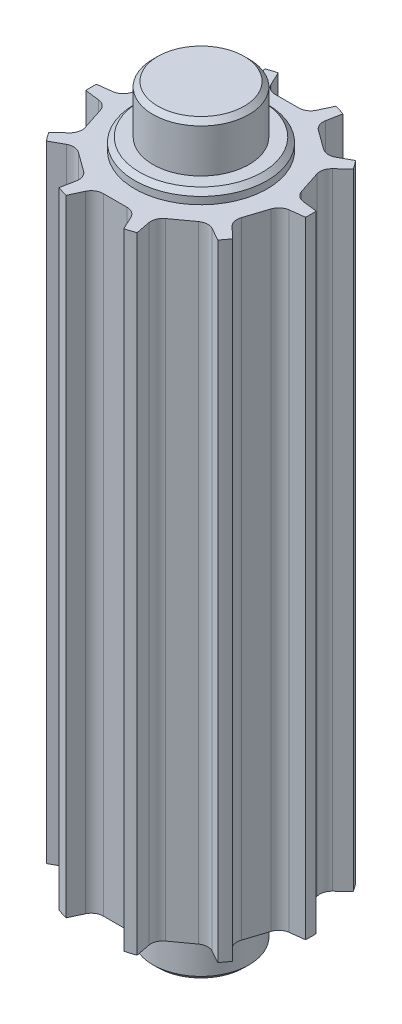
from build123d import *

# Parameters (mm, degrees)
SKIZZE1_R                       = 4.57
AUFSATZ_LINEAR_AUSTRAGEN1_DEPTH = 31
SCHNITT_LINEAR_AUSTRAGEN1_DEPTH = 32.666540702
VERRUNDUNG1_R                   = 0.5
KREISMUSTER1_COUNT              = 10
VERRUNDUNG1_OF_KREISMUSTER1_R   = 0.5
FASE1_SIZE                      = 0.2


with BuildPart() as part:
    # Skizze1 → Aufsatz-Linear austragen1 (new body)
    with BuildSketch(Plane(origin=(0, 0, 0), x_dir=(1, 0, 0), z_dir=(0, 1, 0))):
        Circle(SKIZZE1_R)
    extrude(amount=AUFSATZ_LINEAR_AUSTRAGEN1_DEPTH)

    # Skizze12 → Schnitt-Linear austragen1 (cut, through all)
    with BuildSketch(Plane(origin=(0, 31, 0), x_dir=(1, 0, 0), z_dir=(0, 1, 0))):
        with BuildLine():
            Line((-1.2, 4.409637173), (-0.808470756, 3.57))
            Line((-0.808470756, 3.57), (0.808470756, 3.57))
            Line((0.808470756, 3.57), (1.2, 4.409637173))
            ThreePointArc((1.2, 4.409637173), (0, 4.57), (-1.2, 4.409637173))
        make_face()
    schnitt_linear_austragen1 = extrude(amount=-SCHNITT_LINEAR_AUSTRAGEN1_DEPTH, mode=Mode.SUBTRACT)

    # Verrundung1
    verrundung1_edges = [part.edges().sort_by_distance(p)[0] for p in [
        (-0.808470756, 15.5, -3.57),
        (0.808470756, 15.5, -3.57),
    ]]
    fillet(verrundung1_edges, radius=VERRUNDUNG1_R)

    # Kreismuster1: Schnitt-Linear austragen1 ×10 about axis
    kreismuster1_axis = Axis((0, -1.826859831, 0), (0, 1, 0))
    for i in range(1, KREISMUSTER1_COUNT):
        add(schnitt_linear_austragen1.rotate(kreismuster1_axis, i * 360 / KREISMUSTER1_COUNT), mode=Mode.SUBTRACT)

    # Verrundung1 of Kreismuster1
    verrundung1_of_kreismuster1_edges = [part.edges().sort_by_distance(p)[0] for p in [
        (-2.752459932, 15.5, -2.412983483),
        (-1.44432677, 15.5, -3.363397857),
        (-3.645102966, 15.5, -0.334289289),
        (-3.14544056, 15.5, -1.872092051),
        (-3.14544056, 15.5, 1.872092051),
        (-3.645102966, 15.5, 0.334289289),
        (-1.44432677, 15.5, 3.363397857),
        (-2.752459932, 15.5, 2.412983483),
        (0.808470756, 15.5, 3.57),
        (-0.808470756, 15.5, 3.57),
        (2.752459932, 15.5, 2.412983483),
        (1.44432677, 15.5, 3.363397857),
        (3.645102966, 15.5, 0.334289289),
        (3.14544056, 15.5, 1.872092051),
        (3.14544056, 15.5, -1.872092051),
        (3.645102966, 15.5, -0.334289289),
        (1.44432677, 15.5, -3.363397857),
        (2.752459932, 15.5, -2.412983483),
    ]]
    fillet(verrundung1_of_kreismuster1_edges, radius=VERRUNDUNG1_OF_KREISMUSTER1_R)

    # Skizze13 → Schnitt-Rotation1 (revolve, cut)
    with BuildSketch(Plane(origin=(0, 0, 0), x_dir=(0, 0, -1), z_dir=(1, 0, 0))):
        Polygon((-1.995, 0), (-10.076763041, 0), (-10.076763041, 31), (-1.995, 31), (-1.995, 29), (-2.75, 29), (-2.75, 28.5), (-6.450923694, 28.5), (-6.450923694, 2.5), (-2.75, 2.5), (-2.75, 2), (-1.995, 2), align=None)
    revolve(axis=Axis((0, -5.607699778, 0), (0, 1, 0)), mode=Mode.SUBTRACT)

    # Fase1
    fase1_edges = [part.edges().sort_by_distance(p)[0] for p in [
        (0, 0, -1.995),
        (0, 2, -2.75),
        (0, 29, -2.75),
        (0, 31, -1.995),
    ]]
    chamfer(fase1_edges, length=FASE1_SIZE)

    # Skizze14 → Schnitt-Rotation2 (revolve, cut)
    with BuildSketch(Plane(origin=(0, 0, 0), x_dir=(0, 0, -1), z_dir=(1, 0, 0))):
        Polygon((0, 0), (-0.6, 0), (-0.6, 1.5), (0, 1.748528137), align=None)
    revolve(axis=Axis((0, -2.816169131, 0), (0, 1, 0)), mode=Mode.SUBTRACT)


solid = part.part
